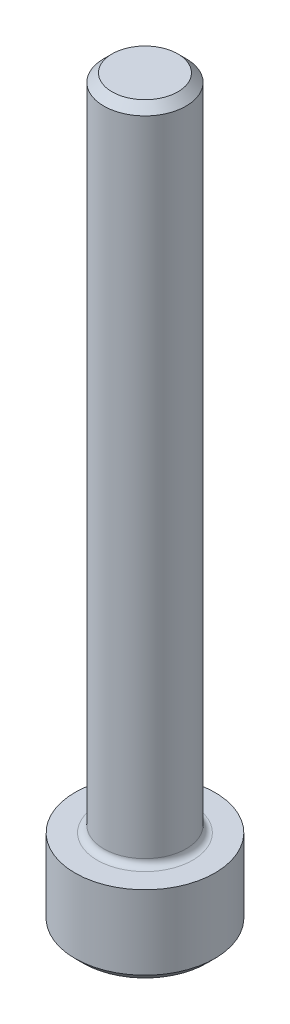
from build123d import *

# Parameters (mm, degrees)
SKETCH2_R           = 2.5
BOSS_EXTRUDE1_DEPTH = 40
SKETCH3_R           = 4.25
BOSS_EXTRUDE2_DEPTH = 5
FILLET1_R           = 0.4
CHAMFER1_SIZE       = 0.5
CUT_EXTRUDE1_DEPTH  = 2.5


with BuildPart() as part:
    # Sketch2 → Boss-Extrude1 (new body)
    with BuildSketch(Plane(origin=(0, 0, 0), x_dir=(1, 0, 0), z_dir=(0, 1, 0))):
        with Locations(Location((0, 0, 0), (0, 0, 270))):
            Circle(SKETCH2_R)
    extrude(amount=BOSS_EXTRUDE1_DEPTH)

    # Sketch3 → Boss-Extrude2 (add)
    with BuildSketch(Plane(origin=(0, 0, 0), x_dir=(1, 0, 0), z_dir=(0, 1, 0))):
        with Locations(Location((0, 0, 0), (0, 0, 270))):
            Circle(SKETCH3_R)
    extrude(amount=-BOSS_EXTRUDE2_DEPTH)

    # Fillet1
    fillet1_edges = [part.edges().sort_by_distance(p)[0] for p in [
        (0, 0, -2.5),
    ]]
    fillet(fillet1_edges, radius=FILLET1_R)

    # Chamfer1
    chamfer1_edges = [part.edges().sort_by_distance(p)[0] for p in [
        (0, 40, -2.5),
        (0, -5, -4.25),
    ]]
    chamfer(chamfer1_edges, length=CHAMFER1_SIZE)

    # Sketch4 → Cut-Extrude1 (cut)
    with BuildSketch(Plane.XZ.offset(5)):
        Polygon((0, 2.309401077), (-2, 1.154700538), (-2, -1.154700538), (0, -2.309401077), (2, -1.154700538), (2, 1.154700538), align=None)
    extrude(amount=-CUT_EXTRUDE1_DEPTH, mode=Mode.SUBTRACT)


solid = part.part
